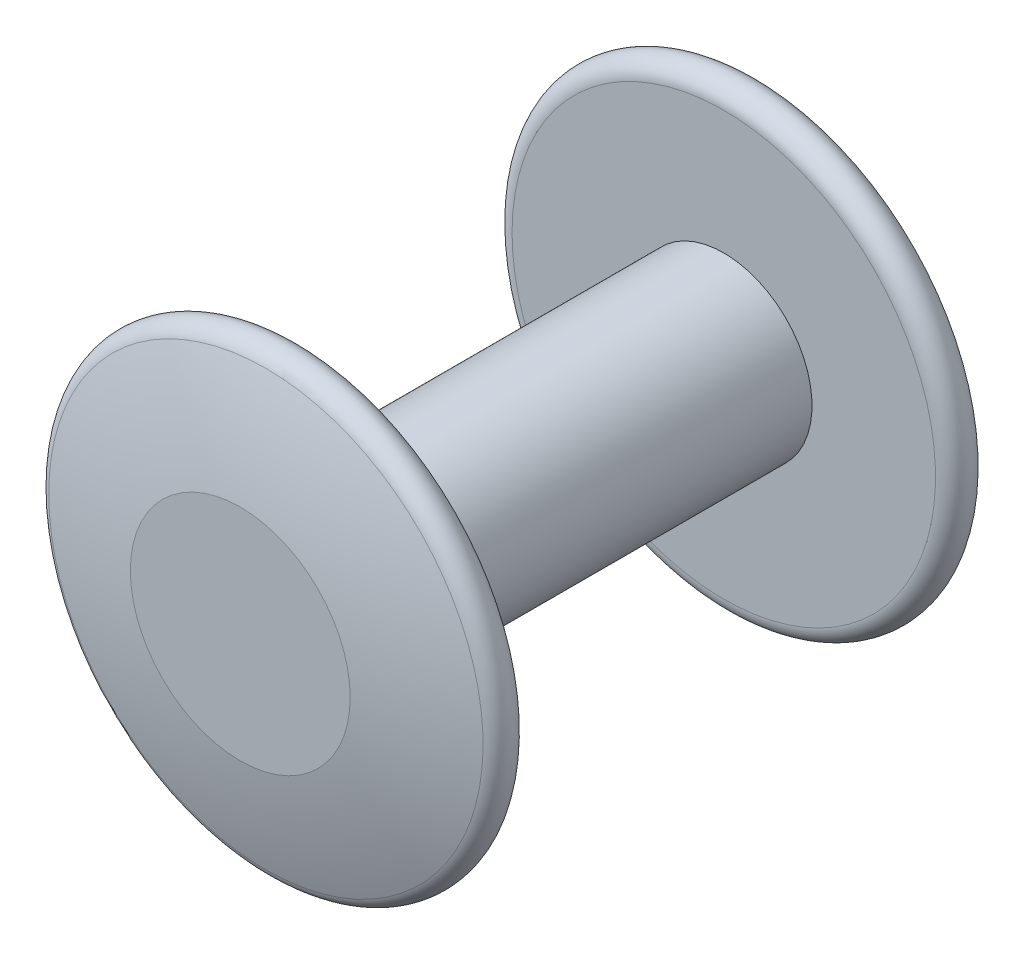
from build123d import *


with BuildPart() as part:
    # Sketch2 → Revolve1 (revolve)
    with BuildSketch(Plane(origin=(0, 0, 0), x_dir=(0, 0, -1), z_dir=(1, 0, 0)), mode=Mode.PRIVATE) as revolve1_sk:
        with BuildLine():
            Line((7.701965126, 0), (7.701965126, 3.114934555))
            ThreePointArc((7.701965126, 3.114934555), (7.398288727, 4.648593724), (6.975742957, 6.153846154))
            ThreePointArc((6.975742957, 6.153846154), (6.422126636, 6.493898511), (6, 6))
            Line((6, 6), (6, 2.5))
            Line((6, 2.5), (-6, 2.5))
            Line((-6, 2.5), (-6, 6))
            ThreePointArc((-6, 6), (-6.422126636, 6.493898511), (-6.975742957, 6.153846154))
            ThreePointArc((-6.975742957, 6.153846154), (-7.398288727, 4.648593724), (-7.701965126, 3.114934555))
            Line((-7.701965126, 3.114934555), (-7.701965126, 0))
            Line((-7.701965126, 0), (7.701965126, 0))
        make_face()
    revolve(revolve1_sk.sketch.rotate(Axis((0, 0, -7.946024685), (0, 0, 1)), 90), axis=Axis((0, 0, -7.946024685), (0, 0, 1)))


solid = part.part
